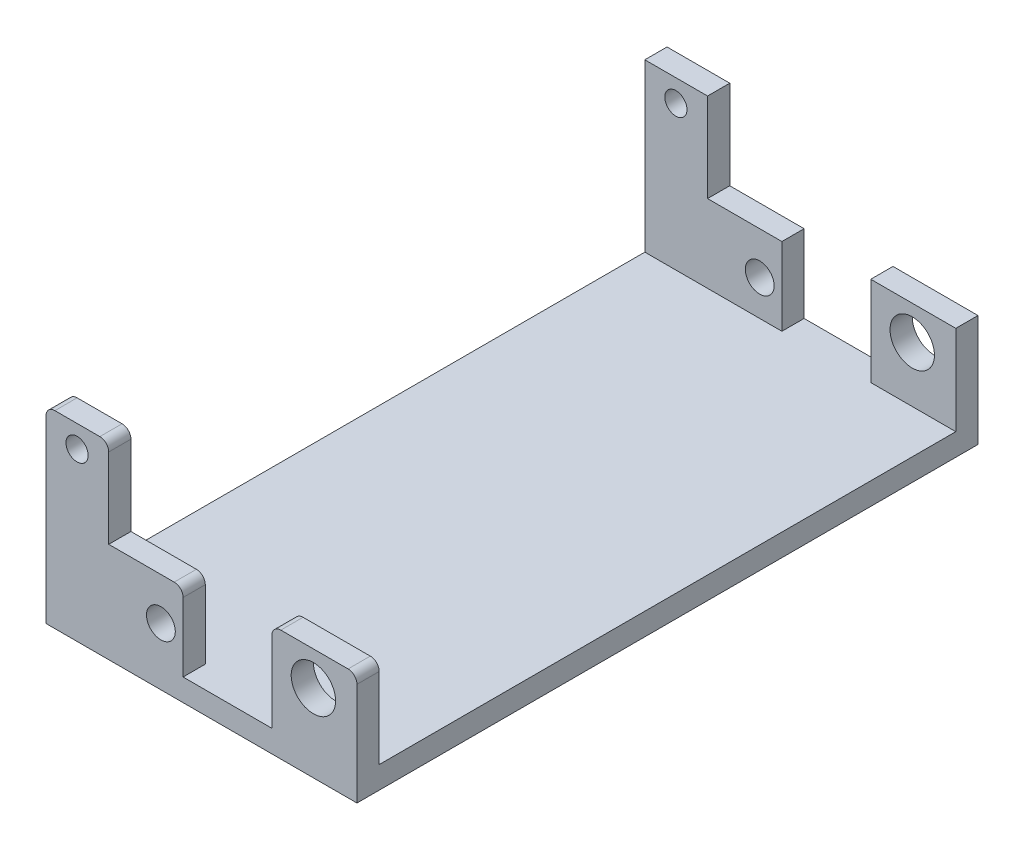
from build123d import *

# Parameters (mm, degrees)
SKETCH1_R           = 6.35
SKETCH1_R_2         = 4.119285102
SKETCH1_R_3         = 3.175
BOSS_EXTRUDE1_DEPTH = 6.35
SKETCH2_W           = 88.9
SKETCH2_H           = 6.35
BOSS_EXTRUDE2_DEPTH = 177.546
FILLET1_R           = 2.54


with BuildPart() as part:
    # Sketch1 → Boss-Extrude1 (new body)
    with BuildSketch(Plane.XY):
        Polygon((44.45, 28.761098675), (20.141329975, 28.761098675), (20.141329975, 3.175), (-5.261436706, 3.175), (-5.261436706, 25.4), (-26.5176, 25.4), (-26.5176, 50.8), (-44.45, 50.8), (-44.45, 3.175), (-44.45, -3.175), (44.45, -3.175), (44.45, 3.175), align=None)
        with Locations((31.995505277, 19.05)):
            Circle(SKETCH1_R, mode=Mode.SUBTRACT)
        with Locations((-11.602215411, 13.310324548)):
            Circle(SKETCH1_R_2, mode=Mode.SUBTRACT)
        with Locations((-35.568494723, 44.45)):
            Circle(SKETCH1_R_3, mode=Mode.SUBTRACT)
    boss_extrude1 = extrude(amount=BOSS_EXTRUDE1_DEPTH)

    # Sketch2 → Boss-Extrude2 (add)
    with BuildSketch(Plane.XY.offset(6.35)):
        Rectangle(SKETCH2_W, SKETCH2_H)
    extrude(amount=-BOSS_EXTRUDE2_DEPTH)

    # Fillet1
    fillet1_edges = [part.edges().sort_by_distance(p)[0] for p in [
        (44.45, 28.761098675, 3.175),
        (-44.45, 50.8, 3.175),
        (-26.5176, 50.8, 3.175),
        (-5.261436706, 25.4, 3.175),
        (20.141329975, 28.761098675, 3.175),
    ]]
    fillet(fillet1_edges, radius=FILLET1_R)

    # Mirror1: Boss-Extrude1 across plane
    add(boss_extrude1.mirror(Plane.XY.offset(-82.423)))


solid = part.part
